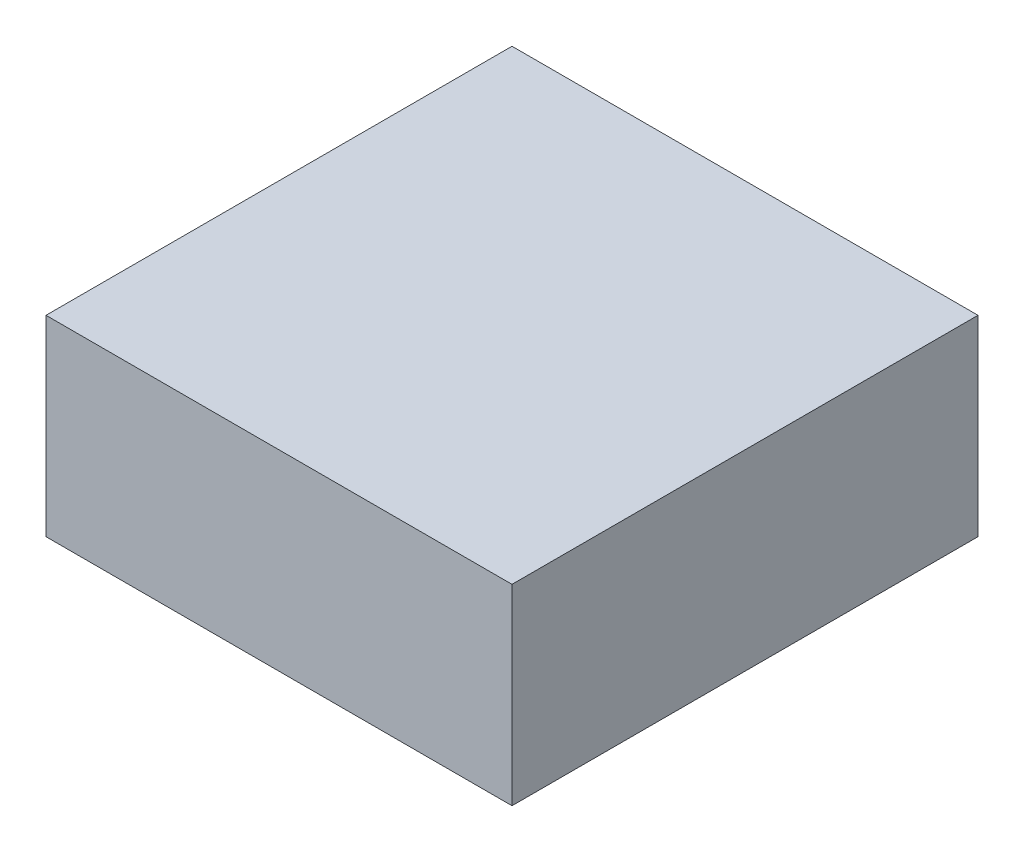
from build123d import *

# Parameters (mm, degrees)
SKETCH_1_W      = 1.13
SKETCH_1_H      = 1.13
EXTRUDE_1_DEPTH = 0.465


with BuildPart() as part:
    # Эскиз1 → Бобышка-Вытянуть1 (new body)
    with BuildSketch(Plane(origin=(0, 0, 0), x_dir=(1, 0, 0), z_dir=(0, 1, 0))):
        with Locations((0.565, -0.565)):
            Rectangle(SKETCH_1_W, SKETCH_1_H)
    extrude(amount=EXTRUDE_1_DEPTH)


solid = part.part
